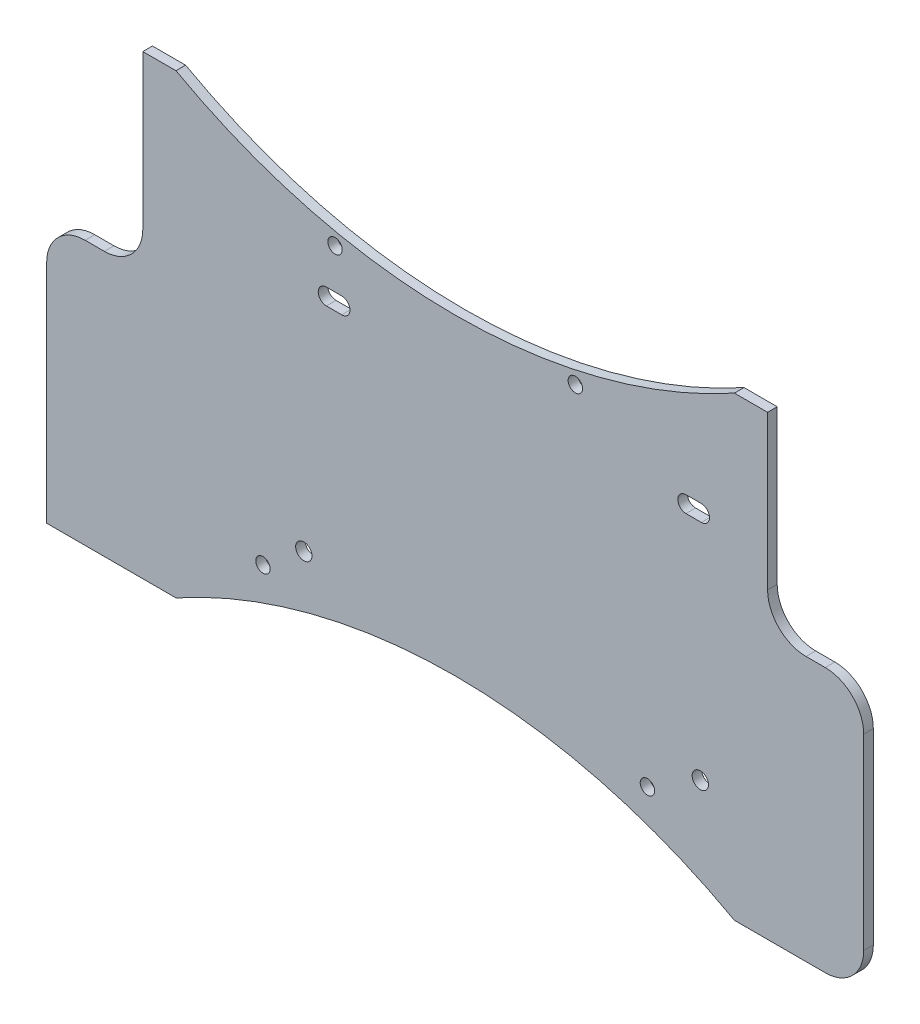
from build123d import *

# Parameters (mm, degrees)
SKETCH2_R           = 1.5
SKETCH2_R_2         = 1.7
BOSS_EXTRUDE1_DEPTH = 2
FILLET4_R           = 8
SKETCH2_3_W         = 20
SKETCH2_3_H         = 55
BOSS_EXTRUDE2_DEPTH = 2
FILLET6_R           = 8
FILLET7_R           = 8


with BuildPart() as part:
    # Sketch2 → Boss-Extrude1 (new body)
    with BuildSketch(Plane.XY):
        with BuildLine():
            Line((65, 7.5), (65, 47.5))
            Line((65, 47.5), (58.094750193, 47.5))
            ThreePointArc((58.094750193, 47.5), (0, 32.5), (-58.094750193, 47.5))
            Line((-58.094750193, 47.5), (-65, 47.5))
            Line((-65, 47.5), (-65, 7.5))
            Line((-65, 7.5), (-85, 7.5))
            Line((-85, 7.5), (-85, -47.5))
            Line((-85, -47.5), (-58.094750193, -47.5))
            ThreePointArc((-58.094750193, -47.5), (0, -32.5), (58.094750193, -47.5))
            Line((58.094750193, -47.5), (65, -47.5))
            Line((65, -47.5), (65, 7.5))
        make_face()
        with Locations((-40, -32.5)):
            Circle(SKETCH2_R, mode=Mode.SUBTRACT)
        with Locations((-31.5, -25.8)):
            Circle(SKETCH2_R_2, mode=Mode.SUBTRACT)
        with Locations((40, -32.5)):
            Circle(SKETCH2_R, mode=Mode.SUBTRACT)
        with Locations((51, -25.8)):
            Circle(SKETCH2_R_2, mode=Mode.SUBTRACT)
        with BuildLine():
            ThreePointArc((-26.8, 20.76), (-28.5, 22.46), (-26.8, 24.16))
            Line((-26.8, 24.16), (-23.6, 24.16))
            ThreePointArc((-23.6, 24.16), (-21.9, 22.46), (-23.6, 20.76))
            Line((-23.6, 20.76), (-26.8, 20.76))
        make_face(mode=Mode.SUBTRACT)
        with Locations((-25, 32.5)):
            Circle(SKETCH2_R, mode=Mode.SUBTRACT)
        with BuildLine():
            ThreePointArc((48.015152789, 20.76), (46.315152789, 22.46), (48.015152789, 24.16))
            Line((48.015152789, 24.16), (51.215152789, 24.16))
            ThreePointArc((51.215152789, 24.16), (52.915152789, 22.46), (51.215152789, 20.76))
            Line((51.215152789, 20.76), (48.015152789, 20.76))
        make_face(mode=Mode.SUBTRACT)
        with Locations((25, 32.5)):
            Circle(SKETCH2_R, mode=Mode.SUBTRACT)
    extrude(amount=BOSS_EXTRUDE1_DEPTH)

    # Fillet4
    fillet4_edges = [part.edges().sort_by_distance(p)[0] for p in [
        (-85, 7.5, 1),
    ]]
    fillet(fillet4_edges, radius=FILLET4_R)

    # Sketch2<3> → Boss-Extrude2 (add)
    with BuildSketch(Plane.XY):
        with Locations((75, -20)):
            Rectangle(SKETCH2_3_W, SKETCH2_3_H)
    extrude(amount=BOSS_EXTRUDE2_DEPTH)

    # Fillet6
    fillet6_edges = [part.edges().sort_by_distance(p)[0] for p in [
        (85, -47.5, 1),
        (85, 7.5, 1),
        (65, 7.5, 1),
    ]]
    fillet(fillet6_edges, radius=FILLET6_R)

    # Fillet7
    fillet7_edges = [part.edges().sort_by_distance(p)[0] for p in [
        (-65, 7.5, 1),
    ]]
    fillet(fillet7_edges, radius=FILLET7_R)


solid = part.part
